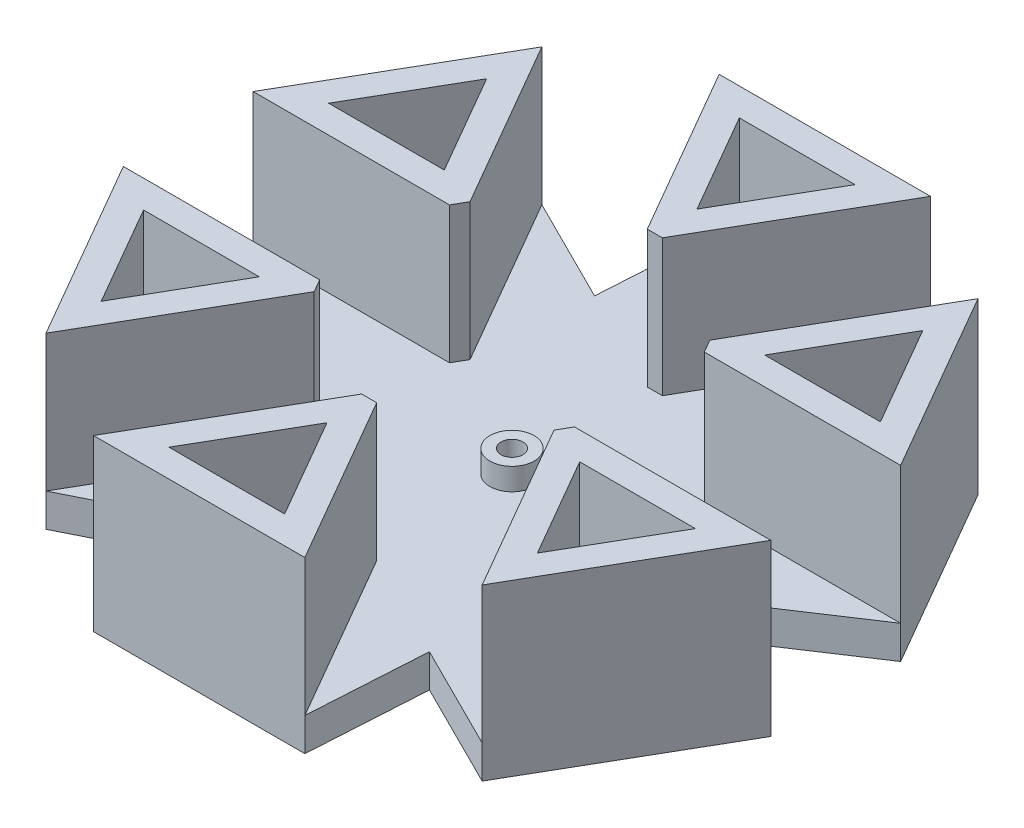
from build123d import *

# Parameters (mm, degrees)
BOSS_EXTRUDE3_DEPTH   = 15.38
BOSS_EXTRUDE3_2_DEPTH = 15.38
BOSS_EXTRUDE3_3_DEPTH = 15.38
BOSS_EXTRUDE3_4_DEPTH = 15.38
BOSS_EXTRUDE3_5_DEPTH = 15.38
BOSS_EXTRUDE3_6_DEPTH = 15.38
SKETCH1_7_R           = 2
BOSS_EXTRUDE5_DEPTH   = 3
SKETCH1_8_R           = 2
SKETCH1_8_R_2         = 1
BOSS_EXTRUDE6_DEPTH   = 5


with BuildPart() as part:
    # Sketch1 → Boss-Extrude3 (new body)
    with BuildSketch(Plane(origin=(0, 0, 0), x_dir=(1, 0, 0), z_dir=(0, 1, 0))):
        Polygon((-109.649519053, 21.267304845), (-128.783493648, 21.267304845), (-119.896742302, 5.875), (-118.536270399, 5.875), align=None)
        Polygon((-124.453366629, 18.767304845), (-113.979646072, 18.767304845), (-119.216506351, 9.69679677), align=None, mode=Mode.SUBTRACT)
    extrude(amount=BOSS_EXTRUDE3_DEPTH)



with BuildPart() as body_2:
    # Sketch1 → Boss-Extrude3 2 (new body)
    with BuildSketch(Plane(origin=(0, 0, 0), x_dir=(1, 0, 0), z_dir=(0, 1, 0))):
        Polygon((-130.072540797, 0), (-138.959292143, 15.392304845), (-148.526279441, -1.17820323), (-130.752776749, -1.17820323), align=None)
        Polygon((-133.722431864, 1.32179677), (-144.196152422, 1.32179677), (-138.959292143, 10.392304845), align=None, mode=Mode.SUBTRACT)
    extrude(amount=BOSS_EXTRUDE3_2_DEPTH)


with BuildPart() as body_3:
    # Sketch1 → Boss-Extrude3 3 (new body)
    with BuildSketch(Plane(origin=(0, 0, 0), x_dir=(1, 0, 0), z_dir=(0, 1, 0))):
        Polygon((-89.906733261, -1.17820323), (-99.473720558, 15.392304845), (-108.360471904, 0), (-107.680235952, -1.17820323), align=None)
        Polygon((-104.710580837, 1.32179677), (-99.473720558, 10.392304845), (-94.23686028, 1.32179677), align=None, mode=Mode.SUBTRACT)
    extrude(amount=BOSS_EXTRUDE3_3_DEPTH)


with BuildPart() as body_4:
    # Sketch1 → Boss-Extrude3 4 (new body)
    with BuildSketch(Plane(origin=(0, 0, 0), x_dir=(1, 0, 0), z_dir=(0, 1, 0))):
        Polygon((-130.752776749, -12.92820323), (-148.526279441, -12.92820323), (-138.959292143, -29.498711305), (-130.072540797, -14.106406459), align=None)
        Polygon((-138.959292143, -24.498711305), (-144.196152422, -15.42820323), (-133.722431864, -15.42820323), align=None, mode=Mode.SUBTRACT)
    extrude(amount=BOSS_EXTRUDE3_4_DEPTH)


with BuildPart() as body_5:
    # Sketch1 → Boss-Extrude3 5 (new body)
    with BuildSketch(Plane(origin=(0, 0, 0), x_dir=(1, 0, 0), z_dir=(0, 1, 0))):
        Polygon((-99.473720558, -29.498711305), (-89.906733261, -12.92820323), (-107.680235952, -12.92820323), (-108.360471904, -14.106406459), align=None)
        Polygon((-94.23686028, -15.42820323), (-99.473720558, -24.498711305), (-104.710580837, -15.42820323), align=None, mode=Mode.SUBTRACT)
    extrude(amount=BOSS_EXTRUDE3_5_DEPTH)


with BuildPart() as body_6:
    # Sketch1 → Boss-Extrude3 6 (new body)
    with BuildSketch(Plane(origin=(0, 0, 0), x_dir=(1, 0, 0), z_dir=(0, 1, 0))):
        Polygon((-119.896742302, -19.981406459), (-128.783493648, -35.373711305), (-109.649519053, -35.373711305), (-118.536270399, -19.981406459), align=None)
        Polygon((-119.216506351, -23.80320323), (-113.979646072, -32.873711305), (-124.453366629, -32.873711305), align=None, mode=Mode.SUBTRACT)
    extrude(amount=BOSS_EXTRUDE3_6_DEPTH)


with BuildPart() as part_1:
    add(part.part)

    add(body_2.part)  # Boss-Extrude5 merges body 2

    add(body_3.part)  # Boss-Extrude5 merges body 3

    add(body_4.part)  # Boss-Extrude5 merges body 4

    add(body_5.part)  # Boss-Extrude5 merges body 5

    add(body_6.part)  # Boss-Extrude5 merges body 6
    # Sketch1<7> → Boss-Extrude5 (add)
    with BuildSketch(Plane(origin=(0, 0, 0), x_dir=(1, 0, 0), z_dir=(0, 1, 0))):
        Polygon((-119.896742302, 5.875), (-128.783493648, 21.267304845), (-129.428017223, 10.633652423), (-138.959292143, 15.392304845), (-130.072540797, 0), (-130.752776749, -1.17820323), (-148.526279441, -1.17820323), (-139.639528095, -7.05320323), (-148.526279441, -12.92820323), (-130.752776749, -12.92820323), (-130.072540797, -14.106406459), (-138.959292143, -29.498711305), (-129.428017223, -24.740058882), (-128.783493648, -35.373711305), (-119.896742302, -19.981406459), (-118.536270399, -19.981406459), (-109.649519053, -35.373711305), (-109.004995479, -24.740058882), (-99.473720558, -29.498711305), (-108.360471904, -14.106406459), (-107.680235952, -12.92820323), (-89.906733261, -12.92820323), (-98.793484607, -7.05320323), (-89.906733261, -1.17820323), (-107.680235952, -1.17820323), (-108.360471904, 0), (-99.473720558, 15.392304845), (-109.004995479, 10.633652423), (-109.649519053, 21.267304845), (-118.536270399, 5.875), align=None)
        with Locations((-119.216506351, -7.05320323)):
            Circle(SKETCH1_7_R, mode=Mode.SUBTRACT)
    extrude(amount=BOSS_EXTRUDE5_DEPTH)

    # Sketch1<8> → Boss-Extrude6 (add)
    with BuildSketch(Plane(origin=(0, 0, 0), x_dir=(1, 0, 0), z_dir=(0, 1, 0))):
        with Locations((-119.216506351, -7.05320323)):
            Circle(SKETCH1_8_R)
        with Locations((-119.216506351, -7.05320323)):
            Circle(SKETCH1_8_R_2, mode=Mode.SUBTRACT)
    extrude(amount=BOSS_EXTRUDE6_DEPTH)


solid = part_1.part
